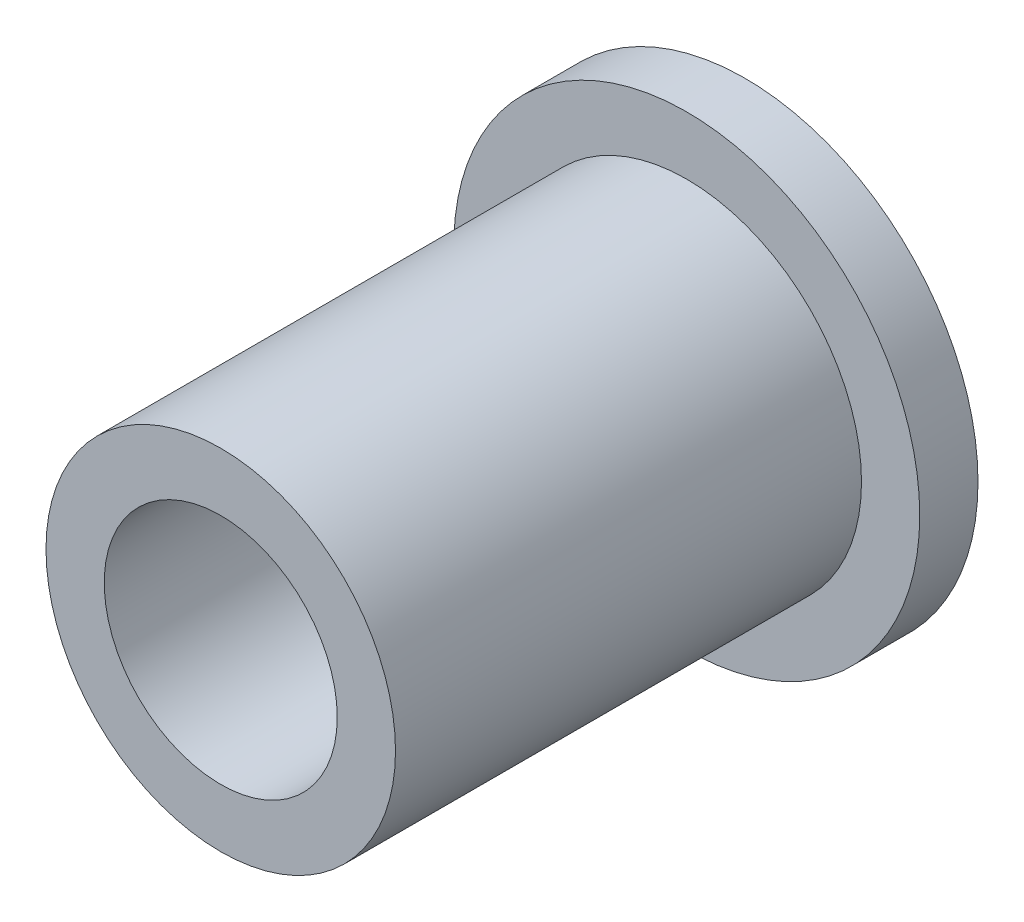
from build123d import *

# Parameters (mm, degrees)
SKETCH_1_R      = 6.35
SKETCH_1_R_2    = 3.175
EXTRUDE_1_DEPTH = 1.5875
EXTRUDE_START   = 12.7
SKETCH_1_3_R    = 4.7625
SKETCH_1_3_R_2  = 3.175
EXTRUDE_2_DEPTH = 12.7


with BuildPart() as part:
    # 草图1 → 凸台-拉伸1 (new body)
    with BuildSketch(Plane.XY):
        Circle(SKETCH_1_R)
        Circle(SKETCH_1_R_2, mode=Mode.SUBTRACT)
    extrude(amount=-EXTRUDE_1_DEPTH)

    # 草图1<3> → 凸台-拉伸2 (add)
    with BuildSketch(Plane.XY.offset(EXTRUDE_START)):
        Circle(SKETCH_1_3_R)
        Circle(SKETCH_1_3_R_2, mode=Mode.SUBTRACT)
    extrude(amount=-EXTRUDE_2_DEPTH)


solid = part.part
